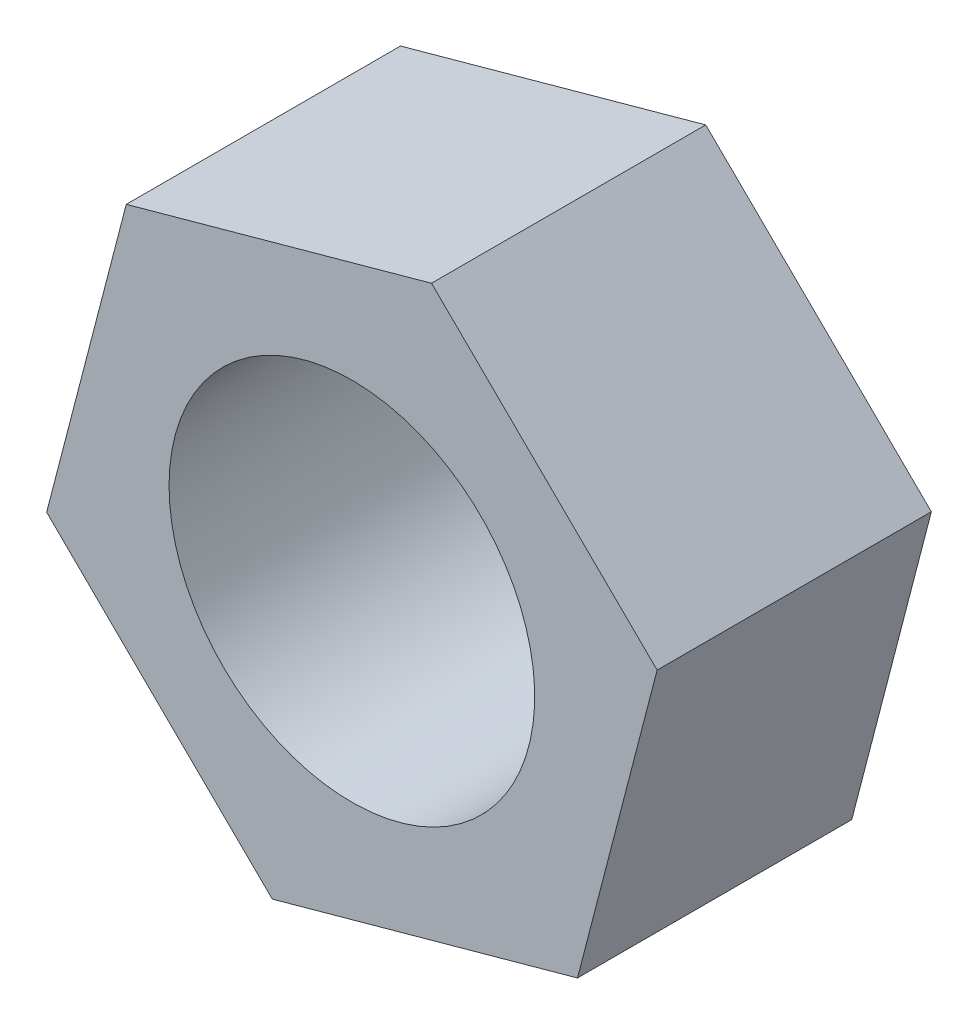
from build123d import *

# Parameters (mm, degrees)
BOSS_EXTRUDE1_DEPTH = 3
SKETCH2_R           = 2
CUT_EXTRUDE1_DEPTH  = 3


with BuildPart() as part:
    # Sketch1 → Boss-Extrude1 (new body)
    with BuildSketch(Plane.XY):
        Polygon((2.468116228, -2.430720528), (3.339123841, 0.922091089), (0.871007612, 3.352811617), (-2.468116228, 2.430720528), (-3.339123841, -0.922091089), (-0.871007612, -3.352811617), align=None)
    extrude(amount=BOSS_EXTRUDE1_DEPTH)

    # Sketch2 → Cut-Extrude1 (cut)
    with BuildSketch(Plane(origin=(0, 0, 0), x_dir=(-1, 0, 0), z_dir=(0, 0, -1))):
        Circle(SKETCH2_R)
    extrude(amount=-CUT_EXTRUDE1_DEPTH, mode=Mode.SUBTRACT)


solid = part.part
